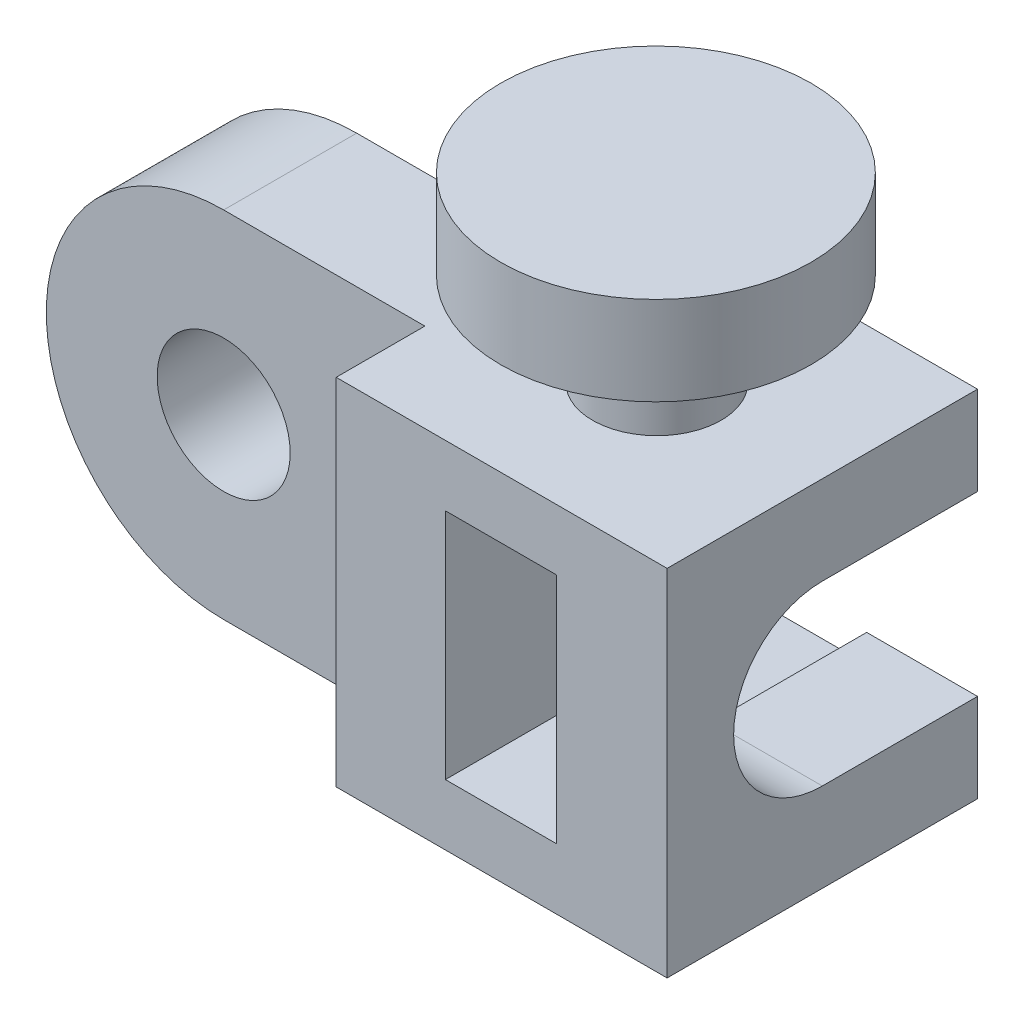
from build123d import *

# Parameters (mm, degrees)
SKETCH1_R               = 1.5
BOSS_EXTRUDE1_DEPTH     = 1.5
SKETCH5_W               = 7.463090523
SKETCH5_H               = 8
BOSS_EXTRUDE2_DEPTH     = 3.5
CUT_EXTRUDE1_DEPTH      = 7
CUT_EXTRUDE1_DEPTH_BACK = 6
SKETCH2_W               = 2.5
SKETCH2_H               = 5.25
SKETCH3_R               = 2
CUT_EXTRUDE2_DEPTH      = 3
SKETCH6_W               = 5
SKETCH6_H               = 4
CUT_EXTRUDE3_DEPTH      = 3.5
SKETCH7_R               = 1.45
BOSS_EXTRUDE3_DEPTH     = 2.1
SKETCH8_R               = 3.5
BOSS_EXTRUDE4_DEPTH     = 2


with BuildPart() as part:
    # Sketch1 → Boss-Extrude1 (new, symmetric)
    with BuildSketch(Plane.XY):
        with BuildLine():
            Line((12, 4), (0, 4))
            ThreePointArc((0, 4), (-4, 0), (0, -4))
            Line((0, -4), (12, -4))
            Line((12, -4), (12, 4))
        make_face()
        Circle(SKETCH1_R, mode=Mode.SUBTRACT)
    extrude(amount=BOSS_EXTRUDE1_DEPTH, both=True)

    # Sketch5 → Boss-Extrude2 (add, symmetric)
    with BuildSketch(Plane.XY):
        with Locations((8.268454739, 0)):
            Rectangle(SKETCH5_W, SKETCH5_H)
    extrude(amount=BOSS_EXTRUDE2_DEPTH, both=True)

    # Sketch2 → Cut-Extrude1 (cut, two sides: drawn at the far end of the back side and taken through both)
    with BuildSketch(Plane.XY.offset(1.5).offset(-CUT_EXTRUDE1_DEPTH_BACK)):
        with Locations((8.25, 0)):
            Rectangle(SKETCH2_W, SKETCH2_H)
    extrude(amount=CUT_EXTRUDE1_DEPTH + CUT_EXTRUDE1_DEPTH_BACK, mode=Mode.SUBTRACT)

    # Sketch3 → Cut-Extrude2 (cut)
    with BuildSketch(Plane(origin=(12, 0, 0), x_dir=(0, 0, -1), z_dir=(1, 0, 0))):
        with Locations(Location((0, 0, 0), (0, 0, 90))):
            Circle(SKETCH3_R)
    extrude(amount=-CUT_EXTRUDE2_DEPTH, mode=Mode.SUBTRACT)

    # Sketch6 → Cut-Extrude3 (cut)
    with BuildSketch(Plane(origin=(0, 0, -3.5), x_dir=(-1, 0, 0), z_dir=(0, 0, -1))):
        with Locations((-12, 0)):
            Rectangle(SKETCH6_W, SKETCH6_H)
    extrude(amount=-CUT_EXTRUDE3_DEPTH, mode=Mode.SUBTRACT)

    # Sketch7 → Boss-Extrude3 (add)
    with BuildSketch(Plane(origin=(0, 4, 0), x_dir=(1, 0, 0), z_dir=(0, 1, 0))):
        with Locations(Location((8.268454739, 0, 0), (0, 0, 180))):
            Circle(SKETCH7_R)
    extrude(amount=BOSS_EXTRUDE3_DEPTH)

    # Sketch8 → Boss-Extrude4 (add)
    with BuildSketch(Plane(origin=(0, 6.1, 0), x_dir=(1, 0, 0), z_dir=(0, 1, 0))):
        with Locations(Location((8.246364187, 0, 0), (0, 0, 180))):
            Circle(SKETCH8_R)
    extrude(amount=BOSS_EXTRUDE4_DEPTH)


solid = part.part
